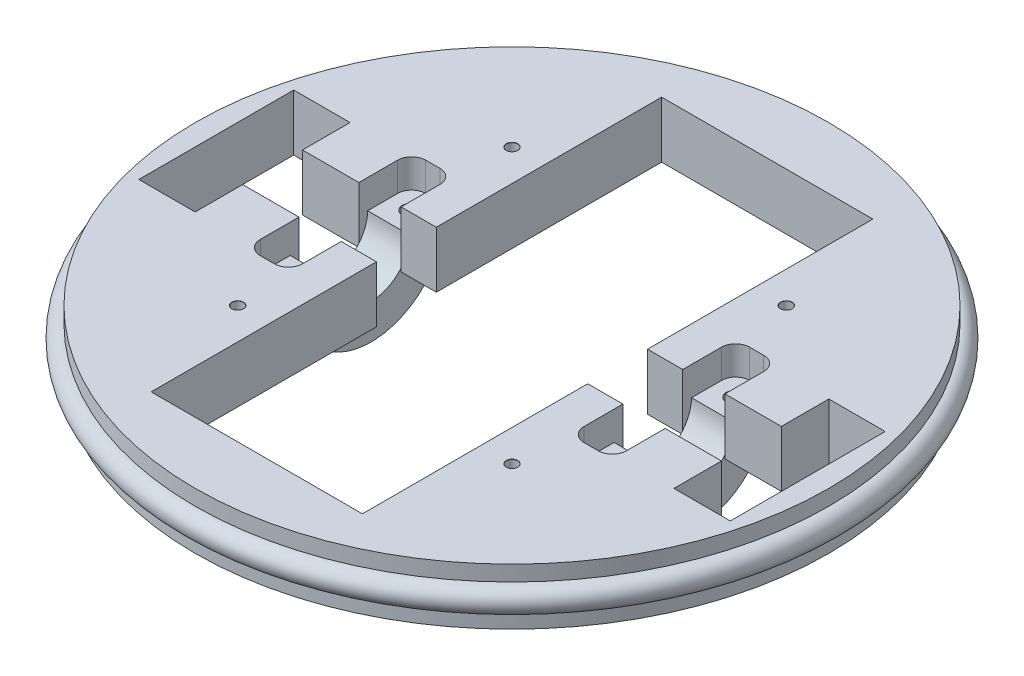
from build123d import *

# Parameters (mm, degrees)
SKETCH1_R                             = 45
BOSS_EXTRUDE1_DEPTH                   = 8
TAP_DRILL_FOR_M2X0_4_TAP1_D           = 1.6
TAP_DRILL_FOR_M2X0_4_TAP1_CSINK_D     = 1.65
TAP_DRILL_FOR_M2X0_4_TAP1_CSINK_ANGLE = 90
SKETCH7_W                             = 6
SKETCH7_H                             = 23.5
CUT_EXTRUDE1_DEPTH                    = 4.1
FILLET1_R                             = 2
BOSS_EXTRUDE2_DEPTH                   = 6
M2_CLEARANCE_HOLE3_D                  = 2.4
SKETCH17_R                            = 1.75
CUT_EXTRUDE2_DEPTH                    = 67.666933473
FILLET1_OF_MIRROR1_R                  = 2


with BuildPart() as part:
    # Sketch1 → Boss-Extrude1 (new body)
    with BuildSketch(Plane(origin=(0, 0, 0), x_dir=(1, 0, 0), z_dir=(0, 1, 0))):
        with Locations(Location((0, 0, 0), (0, 0, 270))):
            Circle(SKETCH1_R)
        Polygon((-15, -36.25), (-15, -4.25), (-20, -4.25), (-20, -5.75), (-26, -5.75), (-26, -4.25), (-34, -4.25), (-34, -11), (-42, -11), (-42, 11), (-34, 11), (-34, 4.25), (-26, 4.25), (-26, 5.75), (-20, 5.75), (-20, 4.25), (-15, 4.25), (-15, 36.25), (15, 36.25), (15, 4.25), (20, 4.25), (20, 5.75), (26, 5.75), (26, 4.25), (34, 4.25), (34, 11), (42, 11), (42, -11), (34, -11), (34, -4.25), (26, -4.25), (26, -5.75), (20, -5.75), (20, -4.25), (15, -4.25), (15, -36.25), align=None, mode=Mode.SUBTRACT)
    extrude(amount=BOSS_EXTRUDE1_DEPTH)

    # Sketch3 → Revolve1 (revolve)
    with BuildSketch(Plane.XY, mode=Mode.PRIVATE) as revolve1_sk:
        with BuildLine():
            Line((-45, 5.8), (-45, 2.2))
            ThreePointArc((-45, 2.2), (-46.8, 4), (-45, 5.8))
        make_face()
    revolve(revolve1_sk.sketch.rotate(Axis((0, 8.4, 0), (0, -1, 0)), 270), axis=Axis((0, 8.4, 0), (0, -1, 0)))

    # Tap Drill for M2x0.4 Tap1 (through all)
    with Locations(Plane(origin=(0, 8, 0), x_dir=(1, 0, 0), z_dir=(0, 1, 0))):
        with Locations((-19.480791822, 19.480791822), (19.480791822, 19.480791822), (19.480791822, -19.480791822), (-19.480791822, -19.480791822)):
            CounterSinkHole(TAP_DRILL_FOR_M2X0_4_TAP1_D / 2, TAP_DRILL_FOR_M2X0_4_TAP1_CSINK_D / 2, counter_sink_angle=TAP_DRILL_FOR_M2X0_4_TAP1_CSINK_ANGLE)

    # Sketch7 → Cut-Extrude1 (cut)
    with BuildSketch(Plane(origin=(0, 8, 0), x_dir=(1, 0, 0), z_dir=(0, 1, 0))):
        with Locations((-23, 0)):
            Rectangle(SKETCH7_W, SKETCH7_H)
    cut_extrude1 = extrude(amount=-CUT_EXTRUDE1_DEPTH, mode=Mode.SUBTRACT)

    # Fillet1
    fillet1_edges = [part.edges().sort_by_distance(p)[0] for p in [
        (-20, 5.95, -11.75),
        (-26, 5.95, 11.75),
        (-26, 5.95, -11.75),
        (-20, 5.95, 11.75),
    ]]
    fillet(fillet1_edges, radius=FILLET1_R)

    # Sketch8 → Boss-Extrude2 (add)
    with BuildSketch(Plane.ZY.offset(20)):
        with BuildLine():
            Line((-5.499090834, 3.9), (-10.499090834, 3.9))
            ThreePointArc((-10.499090834, 3.9), (0, -6.499567055), (10.499090834, 3.9))
            Line((10.499090834, 3.9), (5.499090834, 3.9))
            ThreePointArc((5.499090834, 3.9), (0, -1.5), (-5.499090834, 3.9))
        make_face()
    boss_extrude2 = extrude(amount=BOSS_EXTRUDE2_DEPTH)

    # M2 Clearance Hole3 (through all)
    with Locations(Plane(origin=(0, 3.9, 0), x_dir=(1, 0, 0), z_dir=(0, 1, 0))):
        with Locations((-23, 8.624545417), (-23, -8.624545417)):
            m2_clearance_hole3 = Hole(M2_CLEARANCE_HOLE3_D / 2)

    # Sketch17 → Cut-Extrude2 (cut, through all)
    with BuildSketch(Plane.XZ):
        with Locations((-23, -8.624545417)):
            Circle(SKETCH17_R)
        with Locations((-23, 8.624545417)):
            Circle(SKETCH17_R)
    cut_extrude2 = extrude(amount=CUT_EXTRUDE2_DEPTH, mode=Mode.SUBTRACT)

    # Mirror1: Cut-Extrude1, Boss-Extrude2, M2 Clearance Hole3, Cut-Extrude2 across plane
    add(cut_extrude1.mirror(Plane(origin=(0, 0, 0), x_dir=(0, 0, 1), z_dir=(1, 0, 0))), mode=Mode.SUBTRACT)
    add(boss_extrude2.mirror(Plane(origin=(0, 0, 0), x_dir=(0, 0, 1), z_dir=(1, 0, 0))))
    add(m2_clearance_hole3.mirror(Plane(origin=(0, 0, 0), x_dir=(0, 0, 1), z_dir=(1, 0, 0))), mode=Mode.SUBTRACT)
    add(cut_extrude2.mirror(Plane(origin=(0, 0, 0), x_dir=(0, 0, 1), z_dir=(1, 0, 0))), mode=Mode.SUBTRACT)

    # Fillet1 of Mirror1
    fillet1_of_mirror1_edges = [part.edges().sort_by_distance(p)[0] for p in [
        (20, 5.95, -11.75),
        (26, 5.95, 11.75),
        (26, 5.95, -11.75),
        (20, 5.95, 11.75),
    ]]
    fillet(fillet1_of_mirror1_edges, radius=FILLET1_OF_MIRROR1_R)


solid = part.part
